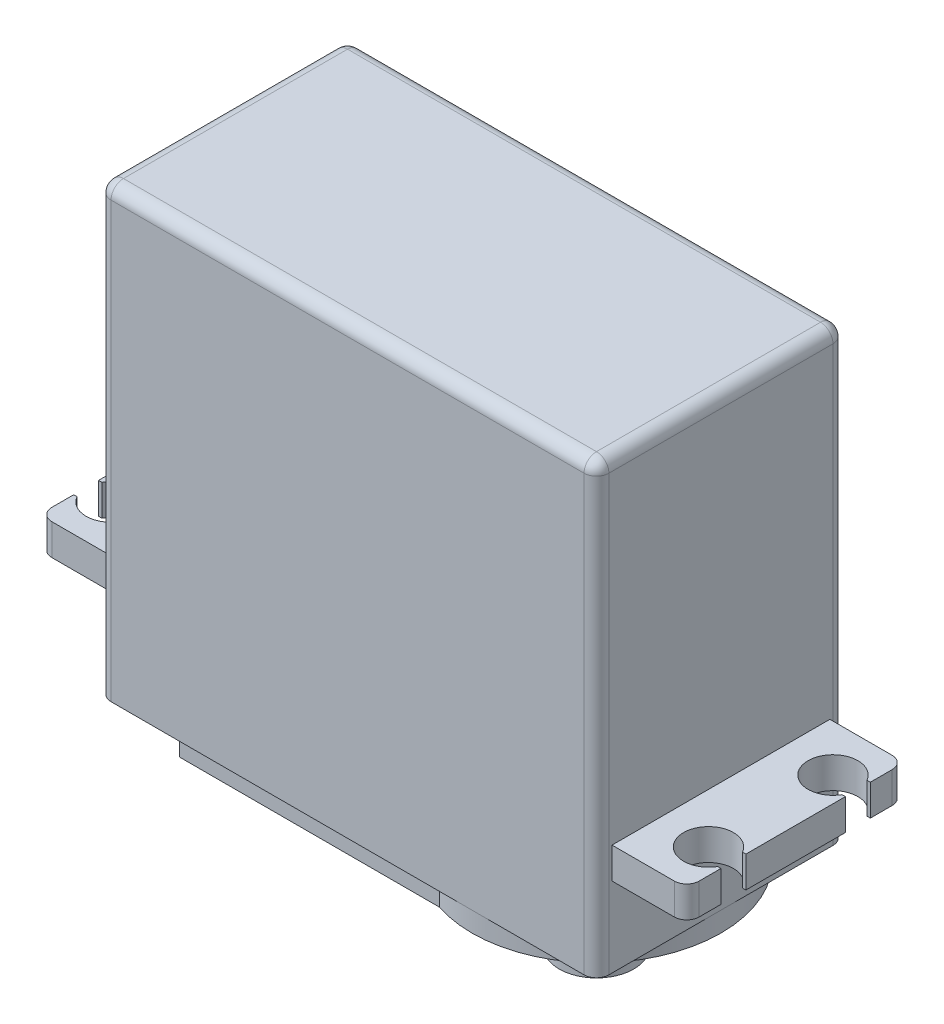
from build123d import *

# Parameters (mm, degrees)
Y_KSEKLIK_EKSTR_ZYON1_DEPTH = 37.5
RADYUS1_R                   = 1
Y_KSEKLIK_EKSTR_ZYON3_DEPTH = 2.5
KES_EKSTR_ZYON1_DEPTH       = 1.6
IZIM4_R                     = 6
Y_KSEKLIK_EKSTR_ZYON4_DEPTH = 1
IZIM5_R                     = 5.5
Y_KSEKLIK_EKSTR_ZYON5_DEPTH = 1
IZIM6_R                     = 3
Y_KSEKLIK_EKSTR_ZYON6_DEPTH = 4


with BuildPart() as part:
    # Çizim1 → Yükseklik-Ekstrüzyon1 (new body)
    with BuildSketch(Plane(origin=(0, 0, 0), x_dir=(1, 0, 0), z_dir=(0, 1, 0))):
        with BuildLine():
            Line((1, 0), (39, 0))
            ThreePointArc((39, 0), (39.707106781, 0.292893219), (40, 1))
            Line((40, 1), (40, 19))
            ThreePointArc((40, 19), (39.707106781, 19.707106781), (39, 20))
            Line((39, 20), (1, 20))
            ThreePointArc((1, 20), (0.292893219, 19.707106781), (0, 19))
            Line((0, 19), (0, 1))
            ThreePointArc((0, 1), (0.292893219, 0.292893219), (1, 0))
        make_face()
    extrude(amount=Y_KSEKLIK_EKSTR_ZYON1_DEPTH)

    # Radyus1
    radyus1_edges = [part.edges().sort_by_distance(p)[0] for p in [
        (0.292893219, 37.5, -19.707106781),
        (0, 37.5, -10),
        (0.292893219, 37.5, -0.292893219),
        (20, 37.5, 0),
        (39.707106781, 37.5, -0.292893219),
        (40, 37.5, -10),
        (39.707106781, 37.5, -19.707106781),
        (20, 37.5, -20),
    ]]
    fillet(radyus1_edges, radius=RADYUS1_R)

    # Çizim2 → Yükseklik-Ekstrüzyon3 (add)
    with BuildSketch(Plane(origin=(0, 10.5, 0), x_dir=(1, 0, 0), z_dir=(0, 1, 0))):
        with BuildLine():
            Line((-5.732050808, 4), (-6, 4))
            Line((-6, 4), (-6, 2.25))
            ThreePointArc((-6, 2.25), (-5.707106781, 1.542893219), (-5, 1.25))
            Line((-5, 1.25), (0, 1.25))
            Line((0, 1.25), (0, 18.75))
            Line((0, 18.75), (-5, 18.75))
            ThreePointArc((-5, 18.75), (-5.707106781, 18.457106781), (-6, 17.75))
            Line((-6, 17.75), (-6, 16))
            Line((-6, 16), (-5.732050808, 16))
            ThreePointArc((-5.732050808, 16), (-2, 15), (-5.732050808, 14))
            Line((-5.732050808, 14), (-6, 14))
            Line((-6, 14), (-6, 6))
            Line((-6, 6), (-5.732050808, 6))
            ThreePointArc((-5.732050808, 6), (-2, 5), (-5.732050808, 4))
        make_face()
        with BuildLine():
            Line((40, 1.25), (45, 1.25))
            ThreePointArc((45, 1.25), (45.707106781, 1.542893219), (46, 2.25))
            Line((46, 2.25), (46, 4))
            Line((46, 4), (45.732050808, 4))
            ThreePointArc((45.732050808, 4), (42, 5), (45.732050808, 6))
            Line((45.732050808, 6), (46, 6))
            Line((46, 6), (46, 14))
            Line((46, 14), (45.732050808, 14))
            ThreePointArc((45.732050808, 14), (42, 15), (45.732050808, 16))
            Line((45.732050808, 16), (46, 16))
            Line((46, 16), (46, 17.75))
            ThreePointArc((46, 17.75), (45.707106781, 18.457106781), (45, 18.75))
            Line((45, 18.75), (40, 18.75))
            Line((40, 18.75), (40, 1.25))
        make_face()
    extrude(amount=-Y_KSEKLIK_EKSTR_ZYON3_DEPTH)

    # Çizim3 → Kes-Ekstrüzyon1 (cut)
    with BuildSketch(Plane.XZ):
        with BuildLine():
            Line((6, -0.5), (26.877501001, -0.5))
            ThreePointArc((26.877501001, -0.5), (28.418861192, -0.125791167), (30.000000044, 0))
            Line((30.000000044, 0), (1, 0))
            ThreePointArc((1, 0), (0.292893219, -0.292893219), (0, -1))
            Line((0, -1), (0, -19))
            ThreePointArc((0, -19), (0.292893219, -19.707106781), (1, -20))
            Line((1, -20), (30.000000006, -20))
            ThreePointArc((30.000000006, -20), (28.418861173, -19.87420883), (26.877501001, -19.5))
            Line((26.877501001, -19.5), (6, -19.5))
            Line((6, -19.5), (6, -14))
            ThreePointArc((6, -14), (4.744562647, -10), (6, -6))
            Line((6, -6), (6, -0.5))
        make_face()
        with BuildLine():
            Line((40, -19), (40, -10))
            ThreePointArc((40, -10), (37.071067814, -17.07106781), (30.000000006, -20))
            Line((30.000000006, -20), (39, -20))
            ThreePointArc((39, -20), (39.707106781, -19.707106781), (40, -19))
        make_face()
        with BuildLine():
            Line((39, 0), (30.000000044, 0))
            ThreePointArc((30.000000044, 0), (37.071067828, -2.928932204), (40, -10))
            Line((40, -10), (40, -1))
            ThreePointArc((40, -1), (39.707106781, -0.292893219), (39, 0))
        make_face()
    extrude(amount=-KES_EKSTR_ZYON1_DEPTH, mode=Mode.SUBTRACT)

    # Çizim4 → Yükseklik-Ekstrüzyon4 (add)
    with BuildSketch(Plane.XZ):
        with Locations(Location((30, -10, 0), (0, 0, 90))):
            Circle(IZIM4_R)
    extrude(amount=Y_KSEKLIK_EKSTR_ZYON4_DEPTH)

    # Çizim5 → Yükseklik-Ekstrüzyon5 (add)
    with BuildSketch(Plane.XZ.offset(1)):
        with Locations(Location((30, -10, 0), (0, 0, 270))):
            Circle(IZIM5_R)
    extrude(amount=Y_KSEKLIK_EKSTR_ZYON5_DEPTH)

    # Çizim6 → Yükseklik-Ekstrüzyon6 (add)
    with BuildSketch(Plane.XZ.offset(2)):
        with Locations(Location((30, -10, 0), (0, 0, 270))):
            Circle(IZIM6_R)
    extrude(amount=Y_KSEKLIK_EKSTR_ZYON6_DEPTH)


solid = part.part
